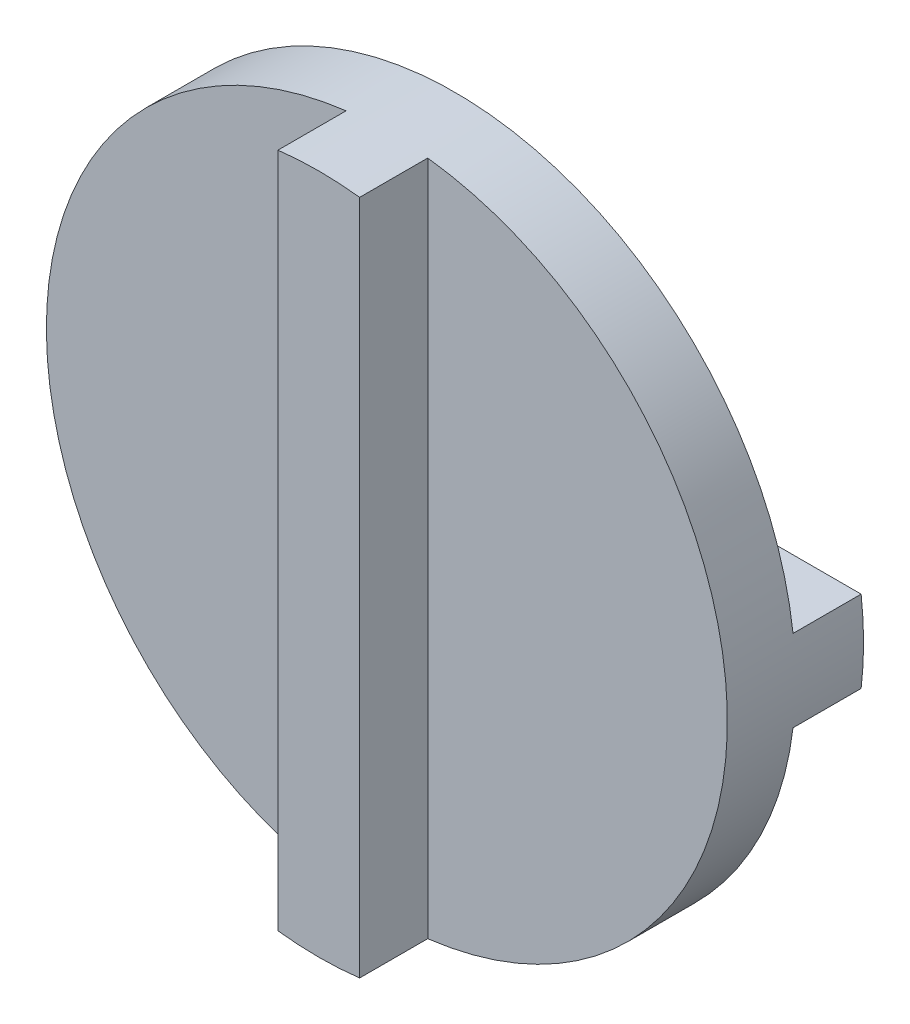
from build123d import *

# Parameters (mm, degrees)
SKETCH1_R           = 50
BOSS_EXTRUDE1_DEPTH = 10
BOSS_EXTRUDE2_DEPTH = 10
BOSS_EXTRUDE3_START = 10
BOSS_EXTRUDE3_DEPTH = 10


with BuildPart() as part:
    # Sketch1 → Boss-Extrude1 (new body)
    with BuildSketch(Plane.XY):
        Circle(SKETCH1_R)
    extrude(amount=BOSS_EXTRUDE1_DEPTH)

    # Sketch2 → Boss-Extrude2 (add)
    with BuildSketch(Plane.XY.offset(10)):
        with BuildLine():
            Line((-6, 49.638694584), (-6, -49.638694584))
            ThreePointArc((-6, -49.638694584), (0, -50), (6, -49.638694584))
            Line((6, -49.638694584), (6, 49.638694584))
            ThreePointArc((6, 49.638694584), (0, 50), (-6, 49.638694584))
        make_face()
    extrude(amount=BOSS_EXTRUDE2_DEPTH)

    # Sketch3 → Boss-Extrude3 (add)
    with BuildSketch(Plane(origin=(0, 0, 0), x_dir=(-1, 0, 0), z_dir=(0, 0, -1)).offset(BOSS_EXTRUDE3_START)):
        with BuildLine():
            Line((-49.638694584, 6), (49.638694584, 6))
            ThreePointArc((49.638694584, 6), (50, 0), (49.638694584, -6))
            Line((49.638694584, -6), (-49.638694584, -6))
            ThreePointArc((-49.638694584, -6), (-50, 0), (-49.638694584, 6))
        make_face()
    extrude(amount=-BOSS_EXTRUDE3_DEPTH)


solid = part.part
